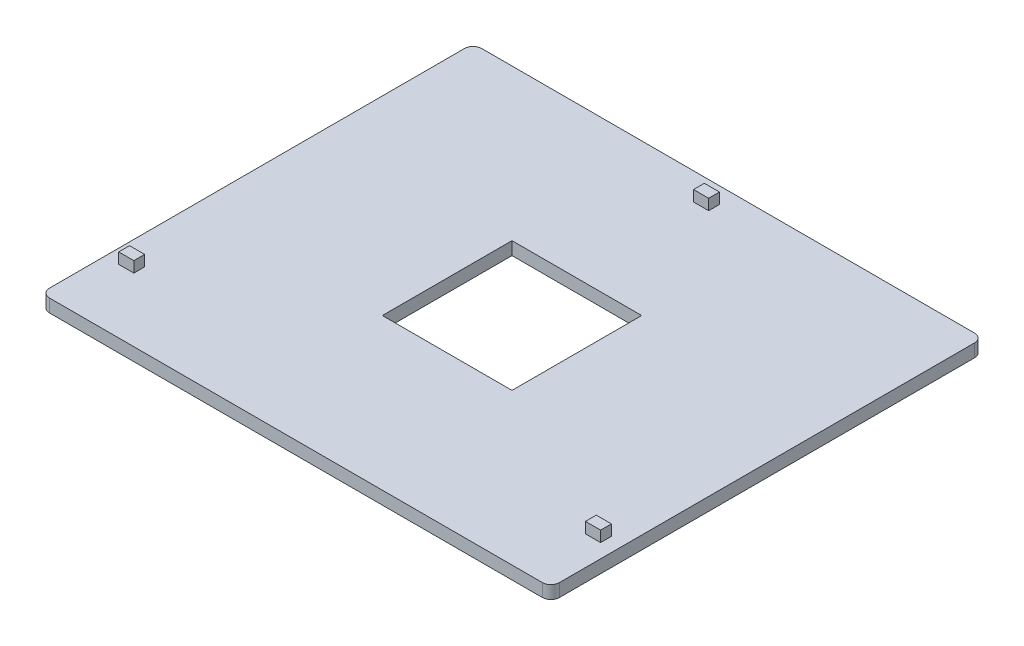
from build123d import *

# Parameters (mm, degrees)
SKETCH1_W           = 118
SKETCH1_H           = 100
SKETCH1_W_2         = 30
SKETCH1_H_2         = 30
BOSS_EXTRUDE1_DEPTH = 3
SKETCH2_W           = 3.5
SKETCH2_H           = 2.5
BOSS_EXTRUDE2_DEPTH = 2.5
FILLET1_R           = 2


with BuildPart() as part:
    # Sketch1 → Boss-Extrude1 (new body)
    with BuildSketch(Plane(origin=(0, 0, 0), x_dir=(1, 0, 0), z_dir=(0, 1, 0))):
        Rectangle(SKETCH1_W, SKETCH1_H)
        Rectangle(SKETCH1_W_2, SKETCH1_H_2, mode=Mode.SUBTRACT)
    extrude(amount=BOSS_EXTRUDE1_DEPTH)

    # Sketch2 → Boss-Extrude2 (add)
    with BuildSketch(Plane(origin=(0, 3, 0), x_dir=(1, 0, 0), z_dir=(0, 1, 0))):
        with Locations((54, -34)):
            Rectangle(SKETCH2_W, SKETCH2_H)
        with Locations((-54, -34)):
            Rectangle(SKETCH2_W, SKETCH2_H)
        with Locations((0, 45)):
            Rectangle(SKETCH2_W, SKETCH2_H)
    extrude(amount=BOSS_EXTRUDE2_DEPTH)

    # Fillet1
    fillet1_edges = [part.edges().sort_by_distance(p)[0] for p in [
        (59, 1.5, 50),
        (-59, 1.5, 50),
        (-59, 1.5, -50),
        (59, 1.5, -50),
    ]]
    fillet(fillet1_edges, radius=FILLET1_R)


solid = part.part
